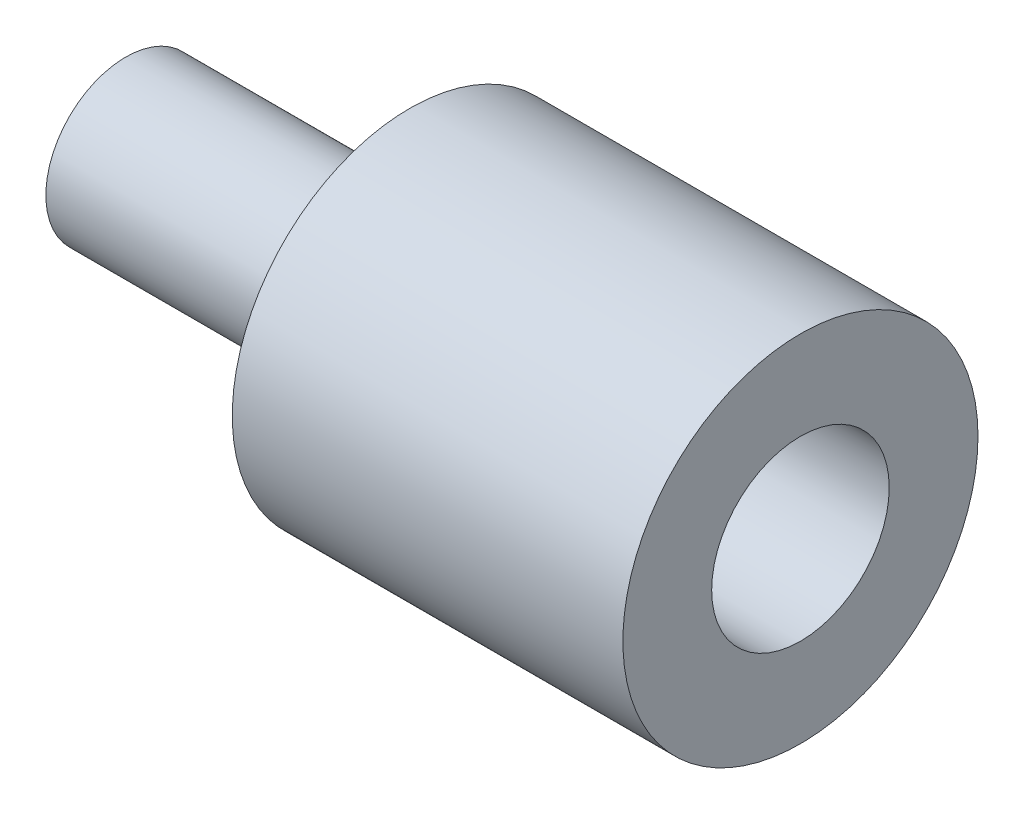
from build123d import *


with BuildPart() as part:
    # Sketch1 → Revolve1 (revolve)
    with BuildSketch(Plane.XY):
        Polygon((0, 0), (0, 4.5), (16, 4.5), (16, 10), (38, 10), (38, 5), (22, 5), (22, 0), align=None)
    revolve(axis=Axis((0, 0, 0), (-1, 0, 0)))


solid = part.part
